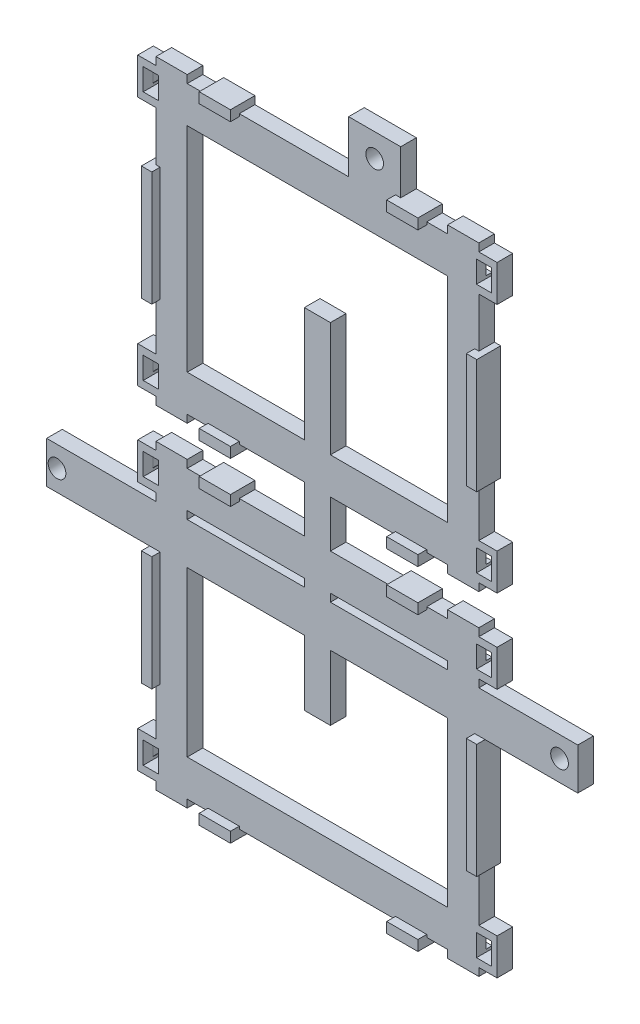
from build123d import *

# Parameters (mm, degrees)
SKETCH_CONNECTED_SUPPORT_RAILS_W = 22.5
SKETCH_CONNECTED_SUPPORT_RAILS_H = 1.5
CONNECTED_SUPPORT_RAILS_DEPTH    = 3
SIDE_STOPS_START                 = 3
SKETCH_SIDE_STOPS_W              = 2
SKETCH_SIDE_STOPS_H              = 22
SIDE_STOPS_DEPTH                 = 1.6
END_STOPS_START                  = 3
SKETCH_END_STOPS_W               = 6
SKETCH_END_STOPS_H               = 2
END_STOPS_DEPTH                  = 1.7
STRAP_PASSAGES_START             = -1
SKETCH_STRAP_PASSAGES_W          = 2.9
SKETCH_STRAP_PASSAGES_H          = 4.2
STRAP_PASSAGES_DEPTH             = 5
FLOOR_M3_START                   = -1
SKETCH_FLOOR_M3_R                = 1.7
FLOOR_M3_DEPTH                   = 6
UNDER_STRAP_RECESS_START         = -0.15
SKETCH_UNDER_STRAP_RECESS_W      = 67
SKETCH_UNDER_STRAP_RECESS_H      = 3.2
UNDER_STRAP_RECESS_DEPTH         = 1.3


with BuildPart() as part:
    # Sketch_Connected_support_rails → Connected_support_rails (new body)
    with BuildSketch(Plane.XY):
        Polygon((-25, -59.5), (-25, -61), (-31, -61), (-31, -59.5), (-34.5, -59.5), (-34.5, -52.5), (-31, -52.5), (-31, -43), (-32.2, -43), (-32.2, -21), (-52, -21), (-52, -13), (-31, -13), (-31, -11.5), (-34.5, -11.5), (-34.5, -4.5), (-31, -4.5), (-31, -3), (-25, -3), (-25, -4.5), (-21, -4.5), (-21, -3), (-15, -3), (-15, -4.5), (-2.5, -4.5), (-2.5, 4.5), (-15, 4.5), (-15, 3), (-21, 3), (-21, 4.5), (-25, 4.5), (-25, 3), (-31, 3), (-31, 4.5), (-34.5, 4.5), (-34.5, 11.5), (-31, 11.5), (-31, 21), (-32.2, 21), (-32.2, 43), (-31, 43), (-31, 52.5), (-34.5, 52.5), (-34.5, 59.5), (-31, 59.5), (-31, 61), (-25, 61), (-25, 59.5), (-21, 59.5), (-21, 61), (-15, 61), (-15, 59.5), (6, 59.5), (6, 69.5), (16, 69.5), (16, 61), (21, 61), (21, 59.5), (25, 59.5), (25, 61), (31, 61), (31, 59.5), (34.5, 59.5), (34.5, 52.5), (31, 52.5), (31, 43), (32.2, 43), (32.2, 21), (31, 21), (31, 11.5), (34.5, 11.5), (34.5, 4.5), (31, 4.5), (31, 3), (25, 3), (25, 4.5), (21, 4.5), (21, 3), (15, 3), (15, 4.5), (2.5, 4.5), (2.5, -4.5), (15, -4.5), (15, -3), (21, -3), (21, -4.5), (25, -4.5), (25, -3), (31, -3), (31, -4.5), (34.5, -4.5), (34.5, -11.5), (31, -11.5), (31, -13), (50, -13), (50, -21), (32.2, -21), (32.2, -43), (31, -43), (31, -52.5), (34.5, -52.5), (34.5, -59.5), (31, -59.5), (31, -61), (25, -61), (25, -59.5), (21, -59.5), (21, -61), (15, -61), (15, -59.5), (-15, -59.5), (-15, -61), (-21, -61), (-21, -59.5), align=None)
        with Locations((13.75, -12.25)):
            Rectangle(SKETCH_CONNECTED_SUPPORT_RAILS_W, SKETCH_CONNECTED_SUPPORT_RAILS_H, mode=Mode.SUBTRACT)
        with Locations((-13.75, -12.25)):
            Rectangle(SKETCH_CONNECTED_SUPPORT_RAILS_W, SKETCH_CONNECTED_SUPPORT_RAILS_H, mode=Mode.SUBTRACT)
        Polygon((2.5, -21), (2.5, -33.5), (-2.5, -33.5), (-2.5, -21), (-25, -21), (-25, -52.5), (25, -52.5), (25, -21), align=None, mode=Mode.SUBTRACT)
        Polygon((-25, 11.5), (-2.5, 11.5), (-2.5, 33.5), (2.5, 33.5), (2.5, 11.5), (25, 11.5), (25, 52.5), (-25, 52.5), align=None, mode=Mode.SUBTRACT)
    extrude(amount=CONNECTED_SUPPORT_RAILS_DEPTH)

    # Sketch_Side_stops → Side_stops (add)
    with BuildSketch(Plane.XY.offset(SIDE_STOPS_START)):
        with Locations((-31.2, -32)):
            Rectangle(SKETCH_SIDE_STOPS_W, SKETCH_SIDE_STOPS_H)
        with Locations((31.2, -32)):
            Rectangle(SKETCH_SIDE_STOPS_W, SKETCH_SIDE_STOPS_H)
        with Locations((-31.2, 32)):
            Rectangle(SKETCH_SIDE_STOPS_W, SKETCH_SIDE_STOPS_H)
        with Locations((31.2, 32)):
            Rectangle(SKETCH_SIDE_STOPS_W, SKETCH_SIDE_STOPS_H)
    extrude(amount=SIDE_STOPS_DEPTH)

    # Sketch_End_stops → End_stops (add)
    with BuildSketch(Plane.XY.offset(END_STOPS_START)):
        with Locations((-18, -60)):
            Rectangle(SKETCH_END_STOPS_W, SKETCH_END_STOPS_H)
        with Locations((18, -60)):
            Rectangle(SKETCH_END_STOPS_W, SKETCH_END_STOPS_H)
        with Locations((-18, -4)):
            Rectangle(SKETCH_END_STOPS_W, SKETCH_END_STOPS_H)
        with Locations((18, -4)):
            Rectangle(SKETCH_END_STOPS_W, SKETCH_END_STOPS_H)
        with Locations((-18, 4)):
            Rectangle(SKETCH_END_STOPS_W, SKETCH_END_STOPS_H)
        with Locations((18, 4)):
            Rectangle(SKETCH_END_STOPS_W, SKETCH_END_STOPS_H)
        with Locations((-18, 60)):
            Rectangle(SKETCH_END_STOPS_W, SKETCH_END_STOPS_H)
        with Locations((18, 60)):
            Rectangle(SKETCH_END_STOPS_W, SKETCH_END_STOPS_H)
    extrude(amount=END_STOPS_DEPTH)

    # Sketch_Strap_passages → Strap_passages (cut)
    with BuildSketch(Plane.XY.offset(STRAP_PASSAGES_START)):
        with Locations((-32, -56)):
            Rectangle(SKETCH_STRAP_PASSAGES_W, SKETCH_STRAP_PASSAGES_H)
        with Locations((32, -56)):
            Rectangle(SKETCH_STRAP_PASSAGES_W, SKETCH_STRAP_PASSAGES_H)
        with Locations((-32, -8)):
            Rectangle(SKETCH_STRAP_PASSAGES_W, SKETCH_STRAP_PASSAGES_H)
        with Locations((32, -8)):
            Rectangle(SKETCH_STRAP_PASSAGES_W, SKETCH_STRAP_PASSAGES_H)
        with Locations((-32, 8)):
            Rectangle(SKETCH_STRAP_PASSAGES_W, SKETCH_STRAP_PASSAGES_H)
        with Locations((32, 8)):
            Rectangle(SKETCH_STRAP_PASSAGES_W, SKETCH_STRAP_PASSAGES_H)
        with Locations((-32, 56)):
            Rectangle(SKETCH_STRAP_PASSAGES_W, SKETCH_STRAP_PASSAGES_H)
        with Locations((32, 56)):
            Rectangle(SKETCH_STRAP_PASSAGES_W, SKETCH_STRAP_PASSAGES_H)
    extrude(amount=STRAP_PASSAGES_DEPTH, mode=Mode.SUBTRACT)

    # Sketch_Floor_M3 → Floor_M3 (cut)
    with BuildSketch(Plane.XY.offset(FLOOR_M3_START)):
        with Locations((-50, -17)):
            Circle(SKETCH_FLOOR_M3_R)
        with Locations((46.5, -17)):
            Circle(SKETCH_FLOOR_M3_R)
        with Locations((11, 65)):
            Circle(SKETCH_FLOOR_M3_R)
    extrude(amount=FLOOR_M3_DEPTH, mode=Mode.SUBTRACT)

    # Sketch_Under_strap_recess → Under_strap_recess (cut)
    with BuildSketch(Plane.XY.offset(UNDER_STRAP_RECESS_START)):
        with Locations((0, -56)):
            Rectangle(SKETCH_UNDER_STRAP_RECESS_W, SKETCH_UNDER_STRAP_RECESS_H)
        with Locations((0, -8)):
            Rectangle(SKETCH_UNDER_STRAP_RECESS_W, SKETCH_UNDER_STRAP_RECESS_H)
        with Locations((0, 8)):
            Rectangle(SKETCH_UNDER_STRAP_RECESS_W, SKETCH_UNDER_STRAP_RECESS_H)
        with Locations((0, 56)):
            Rectangle(SKETCH_UNDER_STRAP_RECESS_W, SKETCH_UNDER_STRAP_RECESS_H)
    extrude(amount=UNDER_STRAP_RECESS_DEPTH, mode=Mode.SUBTRACT)


solid = part.part
